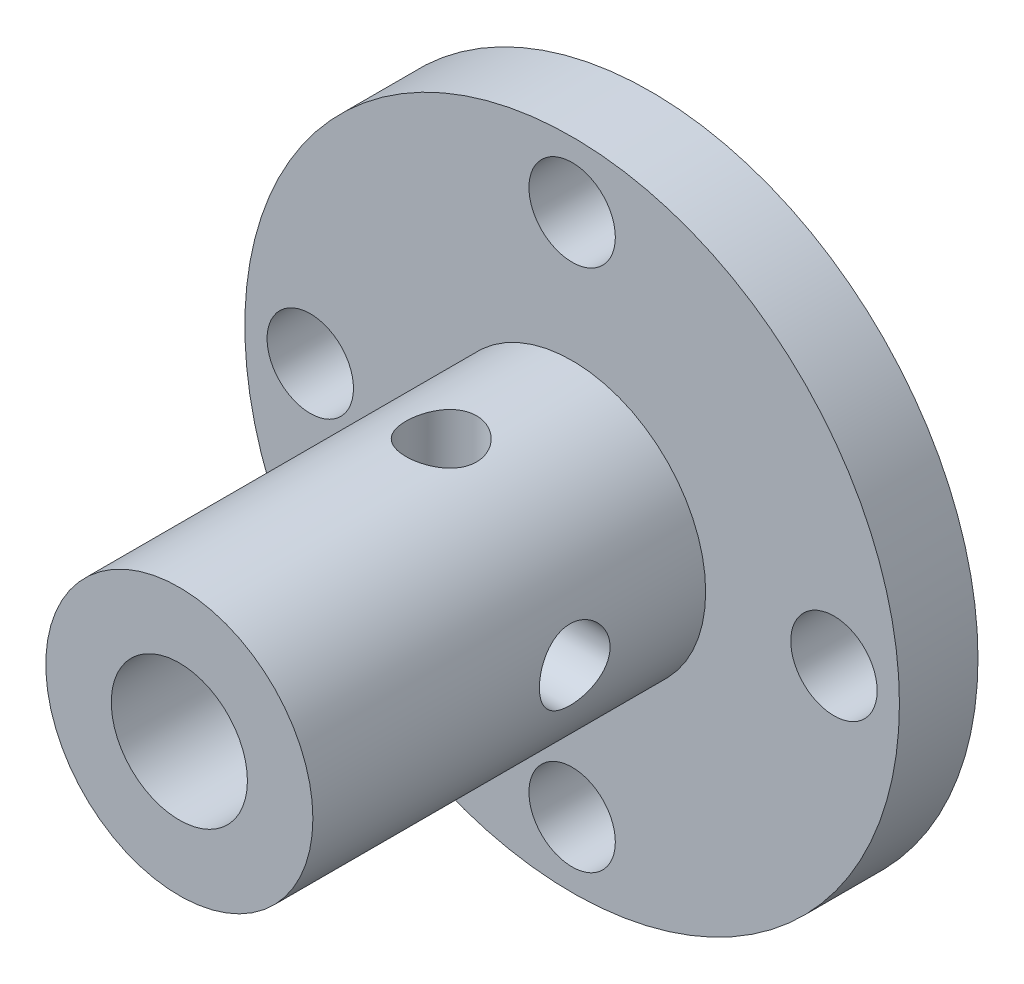
from build123d import *

# Parameters (mm, degrees)
SKETCH_1_R               = 5.1
SKETCH_1_R_2             = 2.6
EXTRUDE_1_DEPTH          = 15
CUT_EXTRUDE_1_DEPTH      = 17.643917808
CUT_EXTRUDE_1_DEPTH_BACK = 17.643917808
SKETCH_2_R               = 1.35
CUT_EXTRUDE_2_DEPTH      = 17.643917959
CUT_EXTRUDE_2_DEPTH_BACK = 17.643917959
SKETCH_3_R               = 1.35
SKETCH_4_R               = 12.5
SKETCH_4_R_2             = 1.65
EXTRUDE_2_DEPTH          = 3


with BuildPart() as part:
    # 草图1 → 凸台-拉伸1 (new body)
    with BuildSketch(Plane.XY):
        Circle(SKETCH_1_R)
        Circle(SKETCH_1_R_2, mode=Mode.SUBTRACT)
    extrude(amount=EXTRUDE_1_DEPTH)

    # 草图2 → 切除-拉伸1 (cut, two sides: drawn at the far end of the back side and taken through both)
    with BuildSketch(Plane(origin=(0, 0, 0), x_dir=(1, 0, 0), z_dir=(0, 1, 0)).offset(-CUT_EXTRUDE_1_DEPTH_BACK)):
        with Locations(Location((0, -5, 0), (0, 0, 90))):
            Circle(SKETCH_2_R)
    extrude(amount=CUT_EXTRUDE_1_DEPTH + CUT_EXTRUDE_1_DEPTH_BACK, mode=Mode.SUBTRACT)

    # 草图3 → 切除-拉伸2 (cut, two sides: drawn at the far end of the back side and taken through both)
    with BuildSketch(Plane(origin=(0, 0, 0), x_dir=(0, 0, -1), z_dir=(1, 0, 0)).offset(-CUT_EXTRUDE_2_DEPTH_BACK)):
        with Locations((-5, 0)):
            Circle(SKETCH_3_R)
    extrude(amount=CUT_EXTRUDE_2_DEPTH + CUT_EXTRUDE_2_DEPTH_BACK, mode=Mode.SUBTRACT)

    # 草图4 → 凸台-拉伸2 (add)
    with BuildSketch(Plane.XY):
        Circle(SKETCH_4_R)
        with Locations((0, -10)):
            Circle(SKETCH_4_R_2, mode=Mode.SUBTRACT)
        with Locations((-10, 0)):
            Circle(SKETCH_4_R_2, mode=Mode.SUBTRACT)
        with Locations((0, 10)):
            Circle(SKETCH_4_R_2, mode=Mode.SUBTRACT)
        with Locations((10, 0)):
            Circle(SKETCH_4_R_2, mode=Mode.SUBTRACT)
    extrude(amount=-EXTRUDE_2_DEPTH)


solid = part.part
